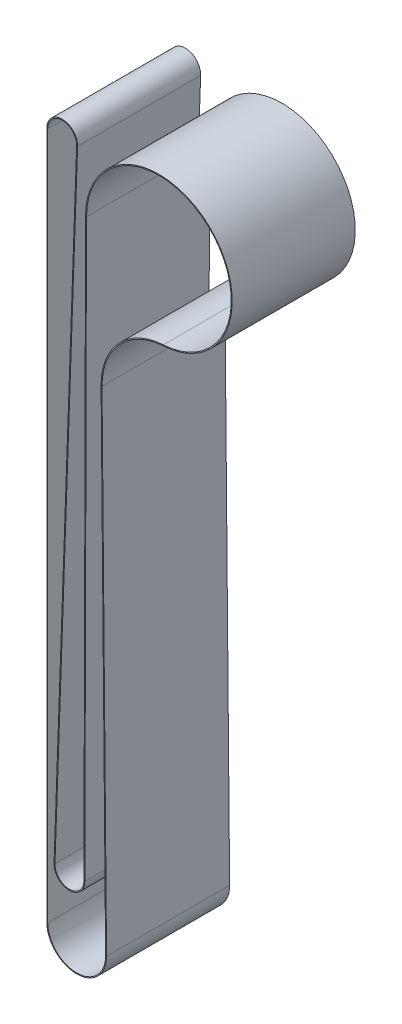
from build123d import *

# Parameters (mm, degrees)
BOSS_EXTRUDE1_DEPTH = 34


with BuildPart() as part:
    # Sketch1 → Boss-Extrude1 (new body)
    with BuildSketch(Plane.XY):
        with BuildLine():
            Line((3.746, 15), (3.746, 43))
            Line((3.746, 43), (3.746, 173))
            Line((3.746, 173), (3.746, 205))
            ThreePointArc((3.746, 205), (8.076040586, 209.25332033), (12.251281537, 204.847943126))
            Line((12.251281537, 204.847943126), (6.002556148, 30.142977785))
            ThreePointArc((6.002556148, 30.142977785), (9.922734835, 26.000746308), (13.999983378, 29.988468323))
            Line((13.999983378, 29.988468323), (14.459106014, 189.24396707))
            ThreePointArc((14.459106014, 189.24396707), (48.621297679, 203.909175827), (35.923887521, 168.967804038))
            ThreePointArc((35.923887521, 168.967804038), (23.840329441, 163.281004469), (19.000766489, 150.833888513))
            Line((19.000766489, 150.833888513), (20.253648522, 15.076171345))
            ThreePointArc((20.253648522, 15.076171345), (12.038086078, 6.74608787), (3.746, 15))
        make_face()
        with BuildLine():
            Line((4, 43), (4, 173))
            Line((4, 173), (4, 205))
            ThreePointArc((4, 205), (8.071500316, 208.999360912), (11.997443852, 204.857022215))
            Line((11.997443852, 204.857022215), (5.748718463, 30.152056874))
            ThreePointArc((5.748718463, 30.152056874), (9.917828497, 25.746793698), (14.253982322, 29.987736062))
            Line((14.253982322, 29.987736062), (14.713104958, 189.243234808))
            ThreePointArc((14.713104958, 189.243234808), (48.446877709, 203.724531103), (35.908702378, 169.221349717))
            ThreePointArc((35.908702378, 169.221349717), (23.654631868, 163.454303088), (18.746777305, 150.831544495))
            Line((18.746777305, 150.831544495), (19.999659338, 15.073827328))
            ThreePointArc((19.999659338, 15.073827328), (12.036914057, 7.000085166), (4, 15))
            Line((4, 15), (4, 43))
        make_face(mode=Mode.SUBTRACT)
    extrude(amount=BOSS_EXTRUDE1_DEPTH)


solid = part.part
